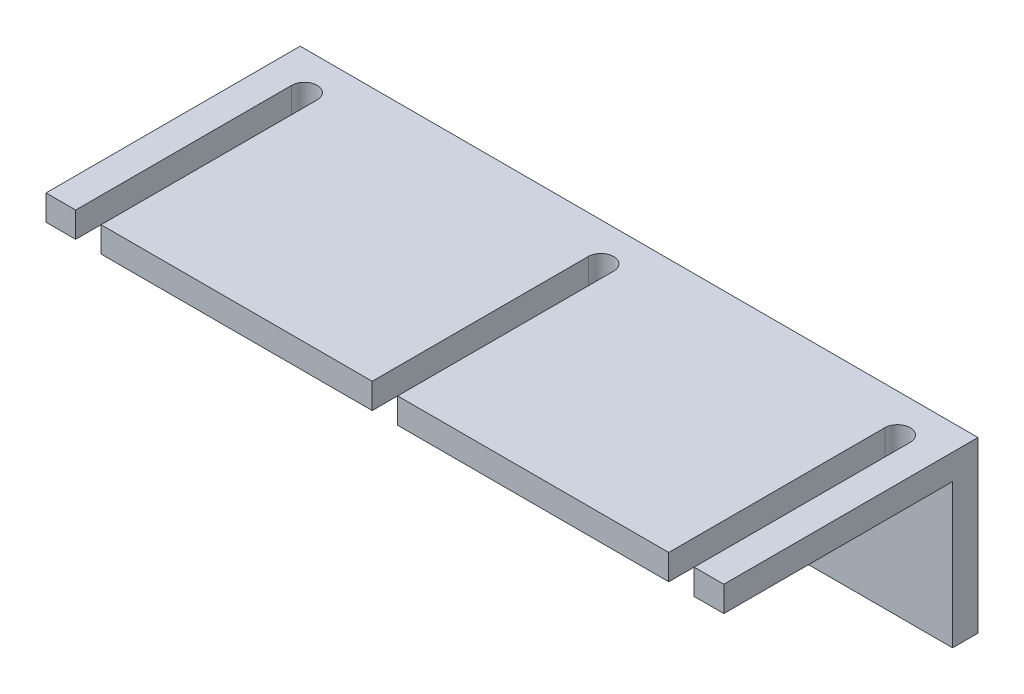
from build123d import *

# Parameters (mm, degrees)
SKETCH_1_W          = 80
SKETCH_1_H          = 20
SKETCH_1_R          = 3
EXTRUDE_1_DEPTH     = 3
SKETCH_2_W          = 80
SKETCH_2_H          = 30
EXTRUDE_2_DEPTH     = 3
CUT_EXTRUDE_1_DEPTH = 20


with BuildPart() as part:
    # 草图1 → 凸台-拉伸1 (new body)
    with BuildSketch(Plane.XY):
        Rectangle(SKETCH_1_W, SKETCH_1_H)
        with Locations((20, 0)):
            Circle(SKETCH_1_R, mode=Mode.SUBTRACT)
        with Locations((-20, 0)):
            Circle(SKETCH_1_R, mode=Mode.SUBTRACT)
    extrude(amount=EXTRUDE_1_DEPTH)

    # 草图2 → 凸台-拉伸2 (add)
    with BuildSketch(Plane(origin=(0, 10, 0), x_dir=(1, 0, 0), z_dir=(0, 1, 0))):
        with Locations((0, -15)):
            Rectangle(SKETCH_2_W, SKETCH_2_H)
    extrude(amount=-EXTRUDE_2_DEPTH)

    # 草图3 → 切除-拉伸1 (cut)
    with BuildSketch(Plane(origin=(0, 10, 0), x_dir=(1, 0, 0), z_dir=(0, 1, 0))):
        with BuildLine():
            Line((-1.5, -4.5), (-1.5, -30))
            Line((-1.5, -30), (1.5, -30))
            Line((1.5, -30), (1.5, -4.5))
            ThreePointArc((1.5, -4.5), (0, -3), (-1.5, -4.5))
        make_face()
        with BuildLine():
            Line((33.5, -4.5), (33.5, -30))
            Line((33.5, -30), (36.5, -30))
            Line((36.5, -30), (36.5, -4.5))
            ThreePointArc((36.5, -4.5), (35, -3), (33.5, -4.5))
        make_face()
        with BuildLine():
            Line((-36.5, -4.5), (-36.5, -30))
            Line((-36.5, -30), (-33.5, -30))
            Line((-33.5, -30), (-33.5, -4.5))
            ThreePointArc((-33.5, -4.5), (-35, -3), (-36.5, -4.5))
        make_face()
    extrude(amount=-CUT_EXTRUDE_1_DEPTH, mode=Mode.SUBTRACT)


solid = part.part
